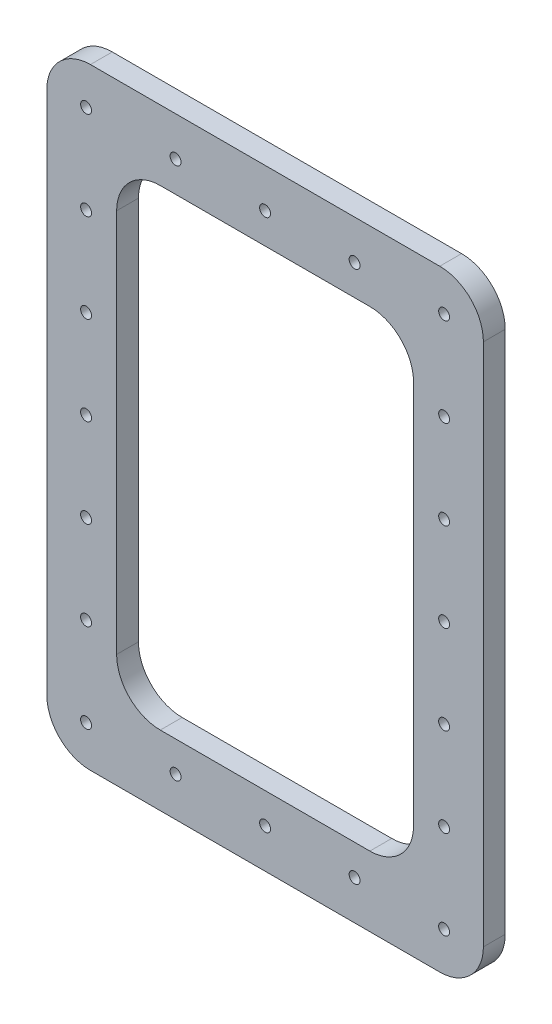
from build123d import *

# Parameters (mm, degrees)
SKETCH1_W           = 100
SKETCH1_H           = 140
SKETCH1_R           = 1.25
SKETCH1_W_2         = 68
SKETCH1_H_2         = 108
BOSS_EXTRUDE1_DEPTH = 5
FILLET1_R           = 10


with BuildPart() as part:
    # Sketch1 → Boss-Extrude1 (new body)
    with BuildSketch(Plane.XY):
        Rectangle(SKETCH1_W, SKETCH1_H)
        with Locations((0, 61)):
            Circle(SKETCH1_R, mode=Mode.SUBTRACT)
        with Locations((-41, 61)):
            Circle(SKETCH1_R, mode=Mode.SUBTRACT)
        with Locations((-20.5, 61)):
            Circle(SKETCH1_R, mode=Mode.SUBTRACT)
        with Locations((20.5, 61)):
            Circle(SKETCH1_R, mode=Mode.SUBTRACT)
        with Locations((41, 61)):
            Circle(SKETCH1_R, mode=Mode.SUBTRACT)
        with Locations((-41, 0)):
            Circle(SKETCH1_R, mode=Mode.SUBTRACT)
        with Locations((-41, 40.666666667)):
            Circle(SKETCH1_R, mode=Mode.SUBTRACT)
        with Locations((-41, 20.333333333)):
            Circle(SKETCH1_R, mode=Mode.SUBTRACT)
        with Locations(Location((41, 40.666666667, 0), (0, 0, 180))):
            Circle(SKETCH1_R, mode=Mode.SUBTRACT)
        with Locations(Location((41, 20.333333333, 0), (0, 0, 180))):
            Circle(SKETCH1_R, mode=Mode.SUBTRACT)
        with Locations(Location((41, 0, 0), (0, 0, 180))):
            Circle(SKETCH1_R, mode=Mode.SUBTRACT)
        with Locations(Location((-20.5, -61, 0), (0, 0, 180))):
            Circle(SKETCH1_R, mode=Mode.SUBTRACT)
        with Locations(Location((0, -61, 0), (0, 0, 180))):
            Circle(SKETCH1_R, mode=Mode.SUBTRACT)
        with Locations(Location((20.5, -61, 0), (0, 0, 180))):
            Circle(SKETCH1_R, mode=Mode.SUBTRACT)
        with Locations(Location((41, -61, 0), (0, 0, 180))):
            Circle(SKETCH1_R, mode=Mode.SUBTRACT)
        with Locations((41, -40.666666667)):
            Circle(SKETCH1_R, mode=Mode.SUBTRACT)
        with Locations((41, -20.333333333)):
            Circle(SKETCH1_R, mode=Mode.SUBTRACT)
        with Locations(Location((-41, -20.333333333, 0), (0, 0, 180))):
            Circle(SKETCH1_R, mode=Mode.SUBTRACT)
        with Locations(Location((-41, -40.666666667, 0), (0, 0, 180))):
            Circle(SKETCH1_R, mode=Mode.SUBTRACT)
        with Locations(Location((-41, -61, 0), (0, 0, 180))):
            Circle(SKETCH1_R, mode=Mode.SUBTRACT)
        Rectangle(SKETCH1_W_2, SKETCH1_H_2, mode=Mode.SUBTRACT)
    extrude(amount=BOSS_EXTRUDE1_DEPTH)

    # Fillet1
    fillet1_edges = [part.edges().sort_by_distance(p)[0] for p in [
        (50, -70, 2.5),
        (-50, -70, 2.5),
        (-50, 70, 2.5),
        (50, 70, 2.5),
        (34, -54, 2.5),
        (34, 54, 2.5),
        (-34, 54, 2.5),
        (-34, -54, 2.5),
    ]]
    fillet(fillet1_edges, radius=FILLET1_R)


solid = part.part
